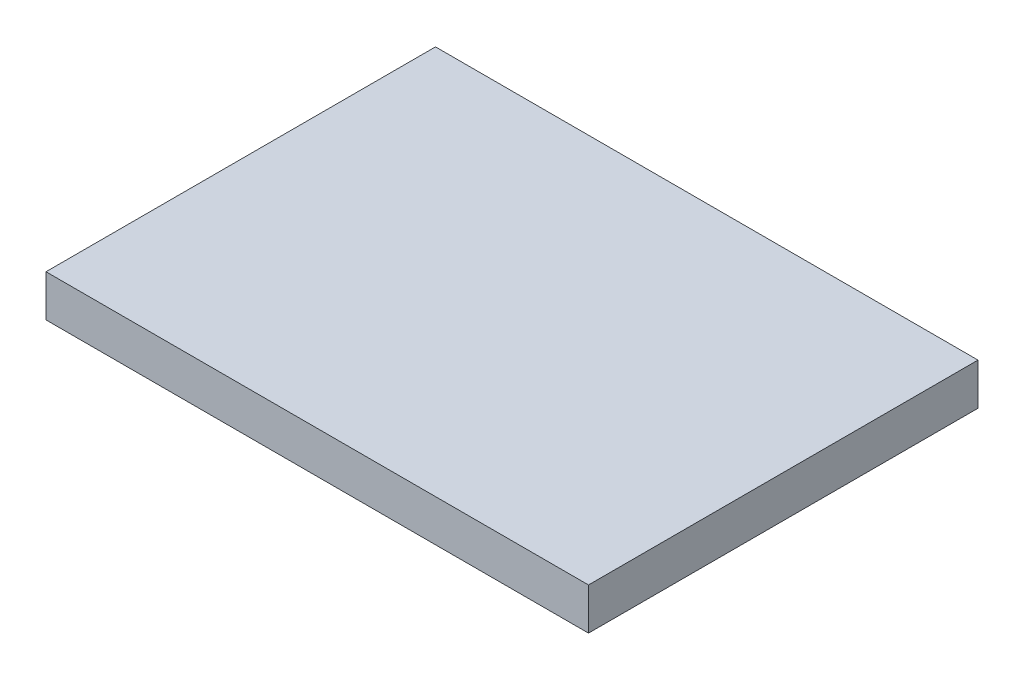
from build123d import *

# Parameters (mm, degrees)
SKETCH1_W           = 495.3
SKETCH1_H           = 355.6
BOSS_EXTRUDE1_DEPTH = 38.1


with BuildPart() as part:
    # Sketch1 → Boss-Extrude1 (new body)
    with BuildSketch(Plane(origin=(0, 0, 0), x_dir=(1, 0, 0), z_dir=(0, 1, 0))):
        Rectangle(SKETCH1_W, SKETCH1_H)
    extrude(amount=BOSS_EXTRUDE1_DEPTH)


solid = part.part
